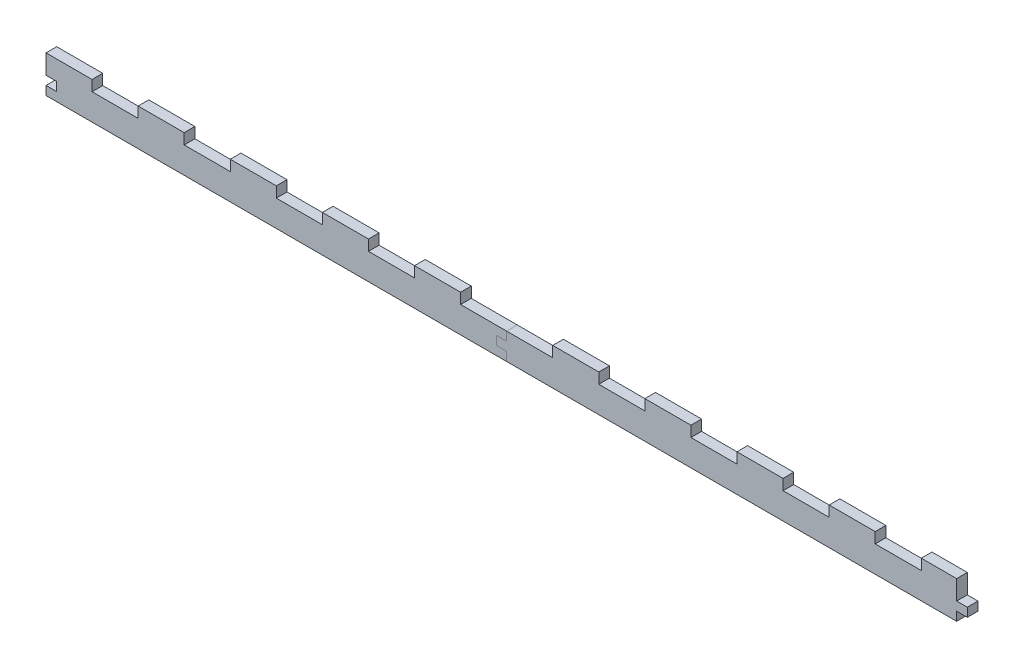
from build123d import *

# Parameters (mm, degrees)
SKETCH1_W              = 444.5
SKETCH1_H              = 12.7
BOSS_EXTRUDE1_DEPTH    = 5.15
SKETCH2_W              = 22.225
SKETCH2_H              = 5.15
BOSS_EXTRUDE2_DEPTH    = 5.15
SKETCH3_W              = 5.15
SKETCH3_H              = 4.233333334
SKETCH3_H_2            = 9.383333333
SKETCH3_H_3            = 4.233333333
CUT_EXTRUDE1_DEPTH     = 445.888070193
SPLIT1_SURFACE_1_BACK  = 445.888
SPLIT1_SURFACE_1_DEPTH = 891.776
SPLIT1_SURFACE_2_BACK  = 445.888
SPLIT1_SURFACE_2_DEPTH = 891.776


with BuildPart() as part:
    # Sketch1 → Boss-Extrude1 (new body)
    with BuildSketch(Plane.XY):
        with Locations((222.25, 6.35)):
            Rectangle(SKETCH1_W, SKETCH1_H)
    extrude(amount=BOSS_EXTRUDE1_DEPTH)

    # Sketch2 → Boss-Extrude2 (add)
    with BuildSketch(Plane.XY.offset(5.15)):
        with Locations((11.1125, 15.275)):
            Rectangle(SKETCH2_W, SKETCH2_H)
        with Locations((55.5625, 15.275)):
            Rectangle(SKETCH2_W, SKETCH2_H)
        with Locations((100.0125, 15.275)):
            Rectangle(SKETCH2_W, SKETCH2_H)
        with Locations((144.4625, 15.275)):
            Rectangle(SKETCH2_W, SKETCH2_H)
        with Locations((188.9125, 15.275)):
            Rectangle(SKETCH2_W, SKETCH2_H)
        with Locations((255.5875, 15.275)):
            Rectangle(SKETCH2_W, SKETCH2_H)
        with Locations((300.0375, 15.275)):
            Rectangle(SKETCH2_W, SKETCH2_H)
        with Locations((344.4875, 15.275)):
            Rectangle(SKETCH2_W, SKETCH2_H)
        with Locations((388.9375, 15.275)):
            Rectangle(SKETCH2_W, SKETCH2_H)
        with Locations((433.3875, 15.275)):
            Rectangle(SKETCH2_W, SKETCH2_H)
    extrude(amount=-BOSS_EXTRUDE2_DEPTH)

    # Sketch3 → Cut-Extrude1 (cut, through all)
    with BuildSketch(Plane.XY.offset(5.15)):
        with Locations((2.575, 6.35)):
            Rectangle(SKETCH3_W, SKETCH3_H)
        with Locations((441.925, 13.158333333)):
            Rectangle(SKETCH3_W, SKETCH3_H_2)
        with Locations((441.925, 2.116666667)):
            Rectangle(SKETCH3_W, SKETCH3_H_3)
    extrude(amount=-CUT_EXTRUDE1_DEPTH, mode=Mode.SUBTRACT)


with BuildPart() as body_2:
    # Split1: the piece behind the surface
    add(part.part)
    # Split1 surface: a surface, the sketch's curves swept straight by 891.776 mm
    with BuildLine(Plane.XY.offset(5.15).offset(-SPLIT1_SURFACE_1_BACK), mode=Mode.PRIVATE) as split1_surface_1_path:
        Line((222.25, 12.7), (222.25, 8.466666667))
        Line((222.25, 8.466666667), (217.25, 8.466666667))
        Line((217.25, 8.466666667), (217.25, 4.233333333))
        Line((217.25, 4.233333333), (222.25, 4.233333333))
        Line((222.25, 4.233333333), (222.25, 0))
    split1_surface_1 = Shell.extrude(split1_surface_1_path.wire(), (0 * SPLIT1_SURFACE_1_DEPTH, 0 * SPLIT1_SURFACE_1_DEPTH, 1 * SPLIT1_SURFACE_1_DEPTH))
    split(bisect_by=split1_surface_1, keep=Keep.BOTTOM)


with BuildPart() as part_1:
    add(part.part)

    # Split1: split by a surface, the side it looks to stays
    # Split1 surface: a surface, the sketch's curves swept straight by 891.776 mm
    with BuildLine(Plane.XY.offset(5.15).offset(-SPLIT1_SURFACE_2_BACK), mode=Mode.PRIVATE) as split1_surface_2_path:
        Line((222.25, 12.7), (222.25, 8.466666667))
        Line((222.25, 8.466666667), (217.25, 8.466666667))
        Line((217.25, 8.466666667), (217.25, 4.233333333))
        Line((217.25, 4.233333333), (222.25, 4.233333333))
        Line((222.25, 4.233333333), (222.25, 0))
    split1_surface_2 = Shell.extrude(split1_surface_2_path.wire(), (0 * SPLIT1_SURFACE_2_DEPTH, 0 * SPLIT1_SURFACE_2_DEPTH, 1 * SPLIT1_SURFACE_2_DEPTH))
    split(bisect_by=split1_surface_2, keep=Keep.TOP)


solid = Compound([body_2.part, part_1.part])
